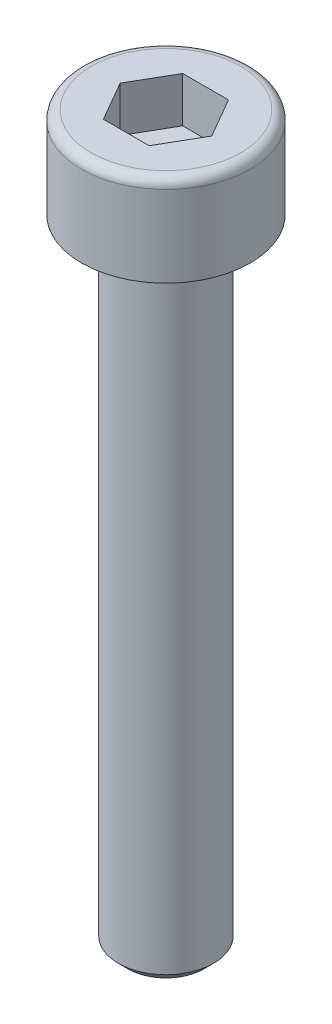
from build123d import *

# Parameters (mm, degrees)
CHAMFER1_SIZE      = 0.3
FILLET1_R          = 0.3
CUT_EXTRUDE1_DEPTH = 1.43


with BuildPart() as part:
    # Sketch1 → Revolve1 (revolve)
    with BuildSketch(Plane.XY, mode=Mode.PRIVATE) as revolve1_sk:
        Polygon((0, 0), (0, 2.86), (2.66, 2.86), (2.66, 0), (1.5, 0), (1.5, -20), (0, -20), align=None)
    revolve(revolve1_sk.sketch.rotate(Axis((0, 2.86, 0), (0, 1, 0)), 90), axis=Axis((0, 2.86, 0), (0, 1, 0)))

    # Chamfer1
    chamfer1_edges = [part.edges().sort_by_distance(p)[0] for p in [
        (0, -20, 1.5),
    ]]
    chamfer(chamfer1_edges, length=CHAMFER1_SIZE)

    # Fillet1
    fillet1_edges = [part.edges().sort_by_distance(p)[0] for p in [
        (0, 2.86, 2.66),
    ]]
    fillet(fillet1_edges, radius=FILLET1_R)

    # Sketch2 → Cut-Extrude1 (cut)
    with BuildSketch(Plane(origin=(0, 2.86, 0), x_dir=(1, 0, 0), z_dir=(0, 1, 0))):
        Polygon((0.721687836, -1.25), (1.443375673, 0), (0.721687836, 1.25), (-0.721687836, 1.25), (-1.443375673, 0), (-0.721687836, -1.25), align=None)
    extrude(amount=-CUT_EXTRUDE1_DEPTH, mode=Mode.SUBTRACT)


solid = part.part
